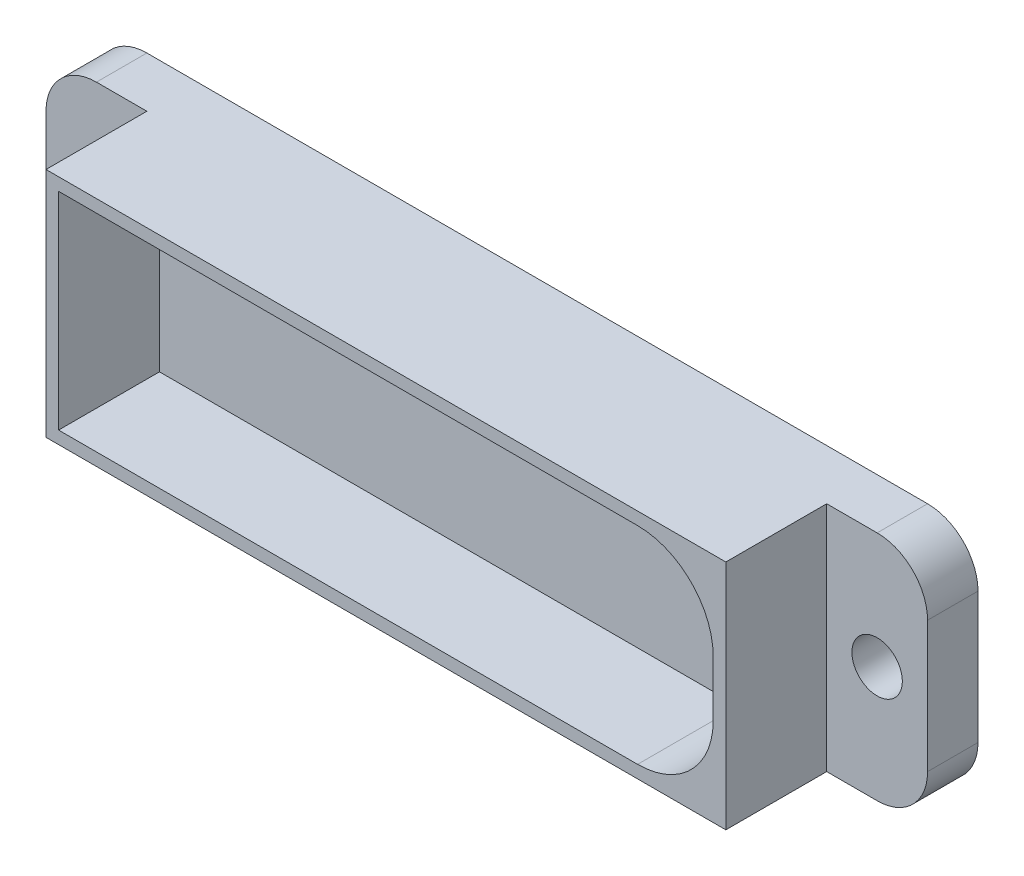
from build123d import *

# Parameters (mm, degrees)
SKETCH1_R           = 1
BOSS_EXTRUDE1_DEPTH = 2
SKETCH2_W           = 26.96
SKETCH2_H           = 9.2
BOSS_EXTRUDE2_DEPTH = 6


with BuildPart() as part:
    # Sketch1 → Boss-Extrude1 (new body)
    with BuildSketch(Plane.XY):
        with BuildLine():
            Line((-15.48, -4.6), (15.48, -4.6))
            ThreePointArc((15.48, -4.6), (16.894213562, -4.014213562), (17.48, -2.6))
            Line((17.48, -2.6), (17.48, 2.6))
            ThreePointArc((17.48, 2.6), (16.894213562, 4.014213562), (15.48, 4.6))
            Line((15.48, 4.6), (-15.48, 4.6))
            ThreePointArc((-15.48, 4.6), (-16.894213562, 4.014213562), (-17.48, 2.6))
            Line((-17.48, 2.6), (-17.48, -2.6))
            ThreePointArc((-17.48, -2.6), (-16.894213562, -4.014213562), (-15.48, -4.6))
        make_face()
        with Locations((-15.48, 0)):
            Circle(SKETCH1_R, mode=Mode.SUBTRACT)
        with Locations((15.48, 0)):
            Circle(SKETCH1_R, mode=Mode.SUBTRACT)
    extrude(amount=BOSS_EXTRUDE1_DEPTH)

    # Sketch2 → Boss-Extrude2 (add)
    with BuildSketch(Plane.XY):
        Rectangle(SKETCH2_W, SKETCH2_H)
        with BuildLine():
            Line((-12.98, 4.1), (-12.98, -4.1))
            Line((-12.98, -4.1), (9.98, -4.1))
            ThreePointArc((9.98, -4.1), (12.101320344, -3.221320344), (12.98, -1.1))
            Line((12.98, -1.1), (12.98, 1.1))
            ThreePointArc((12.98, 1.1), (12.101320344, 3.221320344), (9.98, 4.1))
            Line((9.98, 4.1), (-12.98, 4.1))
        make_face(mode=Mode.SUBTRACT)
    extrude(amount=BOSS_EXTRUDE2_DEPTH)


solid = part.part
